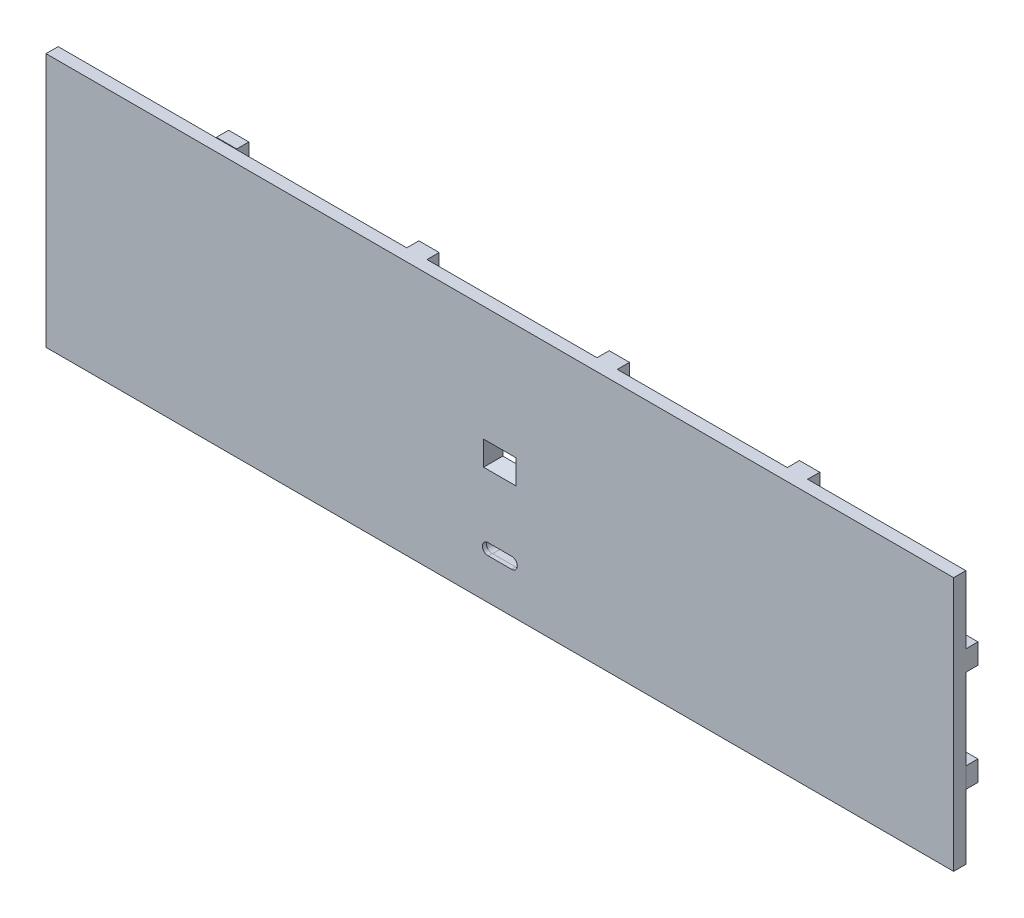
from build123d import *

# Parameters (mm, degrees)
SKETCH_1_W          = 223.7
SKETCH_1_H          = 62.7
EXTRUDE_1_DEPTH     = 3
CUT_EXTRUDE_1_DEPTH = 1
CUT_EXTRUDE_3_DEPTH = 2
EXTRUDE_START       = 4
EXTRUDE_1_2_DEPTH   = 4
SKETCH_13_W         = 25
SKETCH_13_H         = 10
EXTRUDE_2_DEPTH     = 12
SKETCH_14_W         = 41.9
SKETCH_14_H         = 19.999967379
EXTRUDE_3_DEPTH     = 3
SKETCH_15_R         = 2
CUT_EXTRUDE_4_DEPTH = 10
CUT_EXTRUDE_5_DEPTH = 6


with BuildPart() as part:
    # 草图1 → Extrude 1 (new body)
    with BuildSketch(Plane.XY):
        Rectangle(SKETCH_1_W, SKETCH_1_H)
    extrude(amount=-EXTRUDE_1_DEPTH)

    # 草图2 → 切除-拉伸1 (cut)
    with BuildSketch(Plane.XY):
        with BuildLine():
            Line((-2.9, -18.55), (2.9, -18.55))
            ThreePointArc((2.9, -18.55), (4.3, -19.95), (2.9, -21.35))
            Line((2.9, -21.35), (-2.9, -21.35))
            ThreePointArc((-2.9, -21.35), (-4.3, -19.95), (-2.9, -18.55))
        make_face()
    extrude(amount=-CUT_EXTRUDE_1_DEPTH, mode=Mode.SUBTRACT)

    # 草图5 → 切除-拉伸3 (cut)
    with BuildSketch(Plane(origin=(0, 0, -3), x_dir=(-1, 0, 0), z_dir=(0, 0, -1))):
        with BuildLine():
            Line((3, -21.55), (-3, -21.55))
            ThreePointArc((-3, -21.55), (-4.6, -19.95), (-3, -18.35))
            Line((-3, -18.35), (3, -18.35))
            ThreePointArc((3, -18.35), (4.6, -19.95), (3, -21.55))
        make_face()
    extrude(amount=-CUT_EXTRUDE_3_DEPTH, mode=Mode.SUBTRACT)

    # 草图5<2> → Extrude 1 2 (add)
    with BuildSketch(Plane(origin=(0, 0, -3), x_dir=(-1, 0, 0), z_dir=(0, 0, -1)).offset(EXTRUDE_START)):
        with BuildLine():
            Line((-3, -15.35), (3, -15.35))
            ThreePointArc((3, -15.35), (7.6, -19.95), (3, -24.55))
            Line((3, -24.55), (-3, -24.55))
            ThreePointArc((-3, -24.55), (-7.6, -19.95), (-3, -15.35))
        make_face()
        with BuildLine():
            Line((-3, -18.35), (3, -18.35))
            ThreePointArc((3, -18.35), (4.6, -19.95), (3, -21.55))
            Line((3, -21.55), (-3, -21.55))
            ThreePointArc((-3, -21.55), (-4.6, -19.95), (-3, -18.35))
        make_face(mode=Mode.SUBTRACT)
    extrude(amount=-EXTRUDE_1_2_DEPTH)

    # 草图11 → 切除-放样1 section 0
    with BuildSketch(Plane.XY):
        with BuildLine():
            Line((-4, -3), (4, -3))
            Line((4, -3), (4, 3))
            Line((4, 3), (-4, 3))
            Line((-4, 3), (-4, -3))
        make_face()
    # 草图12 → 切除-放样1 section 1
    with BuildSketch(Plane(origin=(0, 0, -3), x_dir=(-1, 0, 0), z_dir=(0, 0, -1))):
        with BuildLine():
            Line((-2.25, 1.25), (2.25, 1.25))
            Line((2.25, 1.25), (2.25, -1.25))
            Line((2.25, -1.25), (-2.25, -1.25))
            Line((-2.25, -1.25), (-2.25, 1.25))
        make_face()
    loft(mode=Mode.SUBTRACT)

    # 草图13 → 凸台-拉伸2 (add)
    with BuildSketch(Plane(origin=(0, 0, -3), x_dir=(-1, 0, 0), z_dir=(0, 0, -1))):
        with Locations((85.35, -26.35)):
            Rectangle(SKETCH_13_W, SKETCH_13_H)
        with Locations((-85.35, -26.35)):
            Rectangle(SKETCH_13_W, SKETCH_13_H)
    extrude(amount=EXTRUDE_2_DEPTH)

    # 草图14 → 凸台-拉伸3 (add)
    with BuildSketch(Plane(origin=(0, 0, -3), x_dir=(-1, 0, 0), z_dir=(0, 0, -1))):
        Polygon((-111.85, 14.649967379), (-111.85, 9.649967379), (-72.85, 9.649967379), (-72.85, -10.35), (-111.82843297, -10.35), (-111.85, -15.35), (-72.85, -15.35), (-72.85, -31.35), (-67.85, -31.35), (-67.85, -15.35), (-25.95, -15.35), (-25.95, -31.35), (-20.95, -31.35), (-20.95, -15.35), (20.95, -15.35), (20.95, -31.35), (25.95, -31.35), (25.95, -15.35), (67.85, -15.35), (67.85, -31.5), (72.85, -31.5), (72.85, -15.35), (111.85, -15.35), (111.85, -10.35), (72.85, -10.35), (72.85, 9.649967379), (111.85, 9.649967379), (111.85, 14.649967379), (72.85, 14.649967379), (72.85, 31.5), (67.85, 31.5), (67.85, 14.649967379), (25.95, 14.649967379), (25.95, 31.35), (20.95, 31.35), (20.95, 14.649967379), (-20.95, 14.649967379), (-20.95, 31.35), (-25.95, 31.35), (-25.95, 14.649967379), (-67.85, 14.649967379), (-67.85, 31.35), (-72.85, 31.35), (-72.85, 14.649967379), align=None)
        with Locations((-46.9, -0.350016311)):
            Rectangle(SKETCH_14_W, SKETCH_14_H, mode=Mode.SUBTRACT)
        with Locations((0, -0.350016311)):
            Rectangle(SKETCH_14_W, SKETCH_14_H, mode=Mode.SUBTRACT)
        with Locations((46.9, -0.350016311)):
            Rectangle(SKETCH_14_W, SKETCH_14_H, mode=Mode.SUBTRACT)
    extrude(amount=EXTRUDE_3_DEPTH)

    # 草图15 → 切除-拉伸4 (cut)
    with BuildSketch(Plane(origin=(0, -31.35, 0), x_dir=(-1, 0, 0), z_dir=(0, -1, 0))):
        with Locations((85.35, 8)):
            Circle(SKETCH_15_R)
        with Locations((-85.35, 8)):
            Circle(SKETCH_15_R)
    extrude(amount=-CUT_EXTRUDE_4_DEPTH, mode=Mode.SUBTRACT)

    # 草图16 → 切除-拉伸5 (cut)
    with BuildSketch(Plane.XZ.offset(31.35)):
        Polygon((-83.329274058, -11.5), (-81.308548116, -8), (-83.329274058, -4.5), (-87.370725942, -4.5), (-89.391451884, -8), (-87.370725942, -11.5), align=None)
        Polygon((87.370725942, -11.5), (89.391451884, -8), (87.370725942, -4.5), (83.329274058, -4.5), (81.308548116, -8), (83.329274058, -11.5), align=None)
    extrude(amount=-CUT_EXTRUDE_5_DEPTH, mode=Mode.SUBTRACT)


solid = part.part
